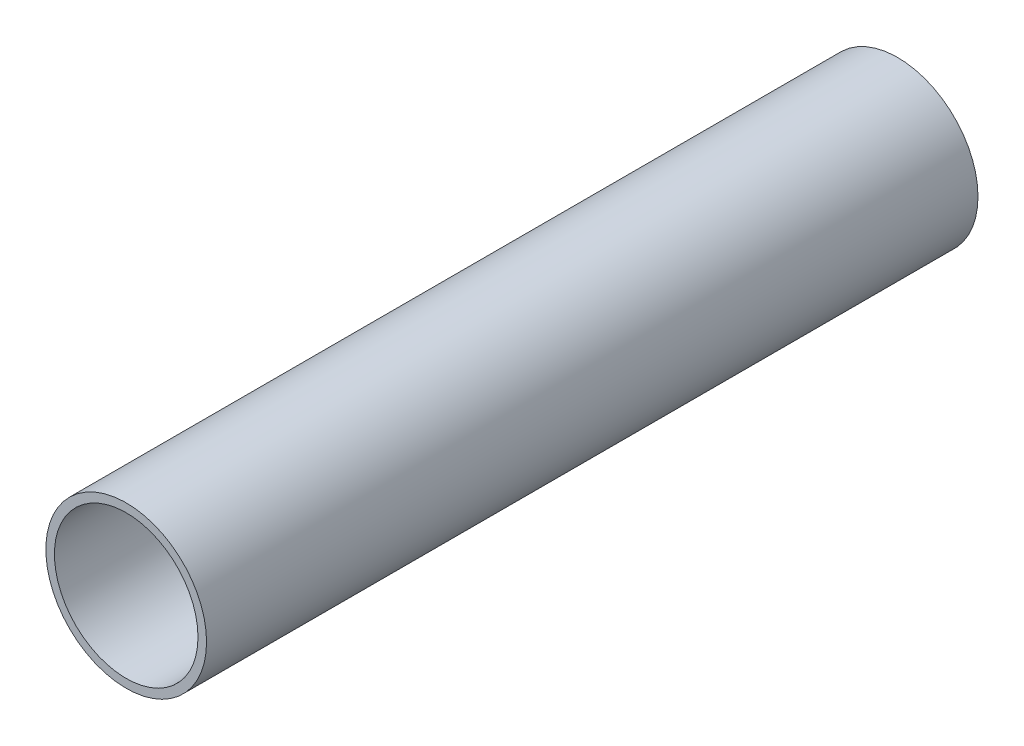
from build123d import *

# Parameters (mm, degrees)
SKETCH1_R           = 1.875
SKETCH1_R_2         = 1.675
BOSS_EXTRUDE1_DEPTH = 18


with BuildPart() as part:
    # Sketch1 → Boss-Extrude1 (new body)
    with BuildSketch(Plane.XY):
        Circle(SKETCH1_R)
        Circle(SKETCH1_R_2, mode=Mode.SUBTRACT)
    extrude(amount=BOSS_EXTRUDE1_DEPTH)


solid = part.part
